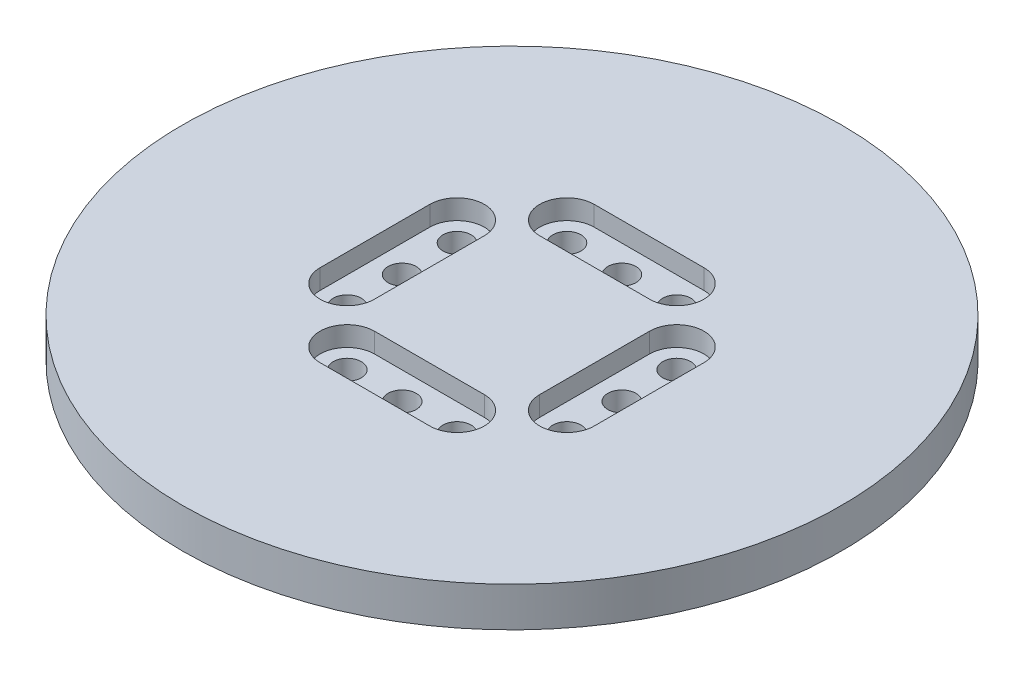
from build123d import *

# Parameters (mm, degrees)
SKETCH_1_R          = 45
EXTRUDE_1_DEPTH     = 4
SKETCH_2_R          = 75
EXTRUDE_2_DEPTH     = 9
SKETCH_3_R          = 3.2
CUT_EXTRUDE_1_DEPTH = 107.85972113
CUT_EXTRUDE_2_DEPTH = 4.5


with BuildPart() as part:
    # 草图1 → 凸台-拉伸1 (new body)
    with BuildSketch(Plane(origin=(0, 0, 0), x_dir=(1, 0, 0), z_dir=(0, 1, 0))):
        with Locations(Location((0, 0, 0), (0, 0, 270))):
            Circle(SKETCH_1_R)
    extrude(amount=EXTRUDE_1_DEPTH)

    # 草图2 → 凸台-拉伸2 (add)
    with BuildSketch(Plane(origin=(0, 4, 0), x_dir=(1, 0, 0), z_dir=(0, 1, 0))):
        with Locations(Location((0, 0, 0), (0, 0, 270))):
            Circle(SKETCH_2_R)
    extrude(amount=EXTRUDE_2_DEPTH)

    # 草图3 → 切除-拉伸1 (cut, through all)
    with BuildSketch(Plane(origin=(0, 13, 0), x_dir=(1, 0, 0), z_dir=(0, 1, 0))):
        with Locations(Location((-12.5, 25, 0), (0, 0, 270))):
            Circle(SKETCH_3_R)
        with Locations(Location((0, 25, 0), (0, 0, 270))):
            Circle(SKETCH_3_R)
        with Locations(Location((12.5, 25, 0), (0, 0, 270))):
            Circle(SKETCH_3_R)
        with Locations(Location((25, 0, 0), (0, 0, 270))):
            Circle(SKETCH_3_R)
        with Locations(Location((25, 12.5, 0), (0, 0, 270))):
            Circle(SKETCH_3_R)
        with Locations(Location((25, -12.5, 0), (0, 0, 270))):
            Circle(SKETCH_3_R)
    cut_extrude_1 = extrude(amount=-CUT_EXTRUDE_1_DEPTH, mode=Mode.SUBTRACT)

    # 镜向1: 切除-拉伸1 across plane
    add(cut_extrude_1.mirror(Plane(origin=(0, 0, 0), x_dir=(0, 0, 1), z_dir=(1, 0, 0))), mode=Mode.SUBTRACT)

    # 镜向1 at the second plane: 切除-拉伸1 across plane
    add(cut_extrude_1.mirror(Plane.XY), mode=Mode.SUBTRACT)

    # 草图4 → 切除-拉伸2 (cut)
    with BuildSketch(Plane(origin=(0, 13, 0), x_dir=(1, 0, 0), z_dir=(0, 1, 0))):
        with BuildLine():
            Line((-12.5, 31.2), (12.5, 31.2))
            ThreePointArc((12.5, 31.2), (18.7, 25), (12.5, 18.8))
            Line((12.5, 18.8), (-12.5, 18.8))
            ThreePointArc((-12.5, 18.8), (-18.7, 25), (-12.5, 31.2))
        make_face()
        with BuildLine():
            Line((-18.8, 12.5), (-18.8, -12.5))
            ThreePointArc((-18.8, -12.5), (-25, -18.7), (-31.2, -12.5))
            Line((-31.2, -12.5), (-31.2, 12.5))
            ThreePointArc((-31.2, 12.5), (-25, 18.7), (-18.8, 12.5))
        make_face()
    cut_extrude_2 = extrude(amount=-CUT_EXTRUDE_2_DEPTH, mode=Mode.SUBTRACT)

    # 镜向2: 切除-拉伸2 across plane
    add(cut_extrude_2.mirror(Plane(origin=(0, 0, 0), x_dir=(0, 0, 1), z_dir=(1, 0, 0))), mode=Mode.SUBTRACT)

    # 镜向2 at the second plane: 切除-拉伸2 across plane
    add(cut_extrude_2.mirror(Plane.XY), mode=Mode.SUBTRACT)


solid = part.part
